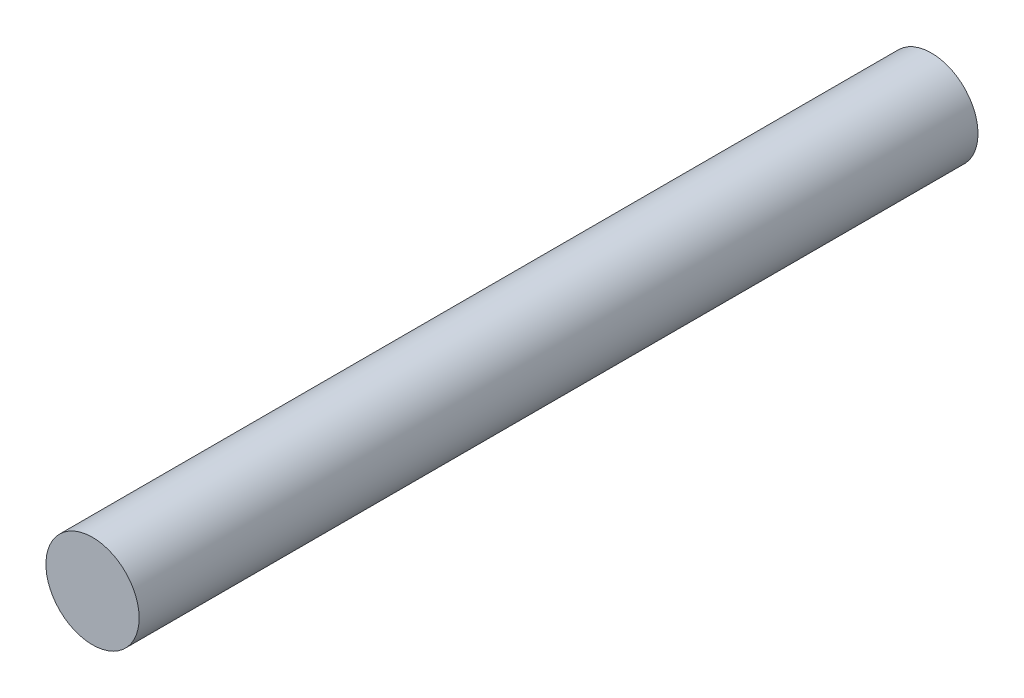
from build123d import *

# Parameters (mm, degrees)
CROQUIS1_R              = 2.95
SALIENTE_EXTRUIR1_DEPTH = 53.1


with BuildPart() as part:
    # Croquis1 → Saliente-Extruir1 (new body)
    with BuildSketch(Plane.XY):
        Circle(CROQUIS1_R)
    extrude(amount=SALIENTE_EXTRUIR1_DEPTH)


solid = part.part
